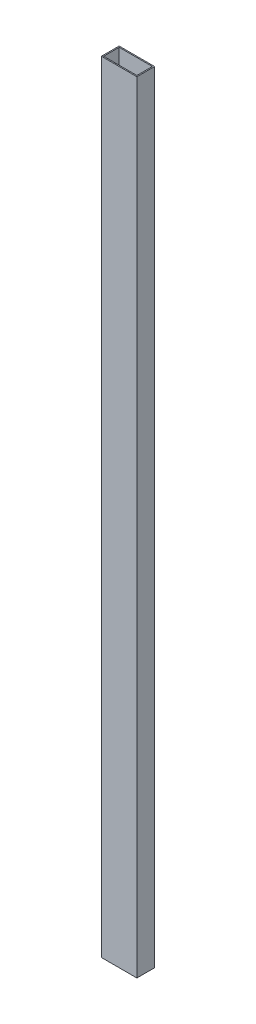
from build123d import *

# Parameters (mm, degrees)
SKETCH2_W           = 50.8
SKETCH2_H           = 25.4
SKETCH2_W_2         = 47.625
SKETCH2_H_2         = 22.225
BOSS_EXTRUDE1_DEPTH = 1117.6


with BuildPart() as part:
    # Sketch2 → Boss-Extrude1 (new body)
    with BuildSketch(Plane(origin=(0, 0, 0), x_dir=(1, 0, 0), z_dir=(0, 1, 0))):
        with Locations((23.8125, 11.1125)):
            Rectangle(SKETCH2_W, SKETCH2_H)
        with Locations((23.8125, 11.1125)):
            Rectangle(SKETCH2_W_2, SKETCH2_H_2, mode=Mode.SUBTRACT)
    extrude(amount=BOSS_EXTRUDE1_DEPTH)


solid = part.part
